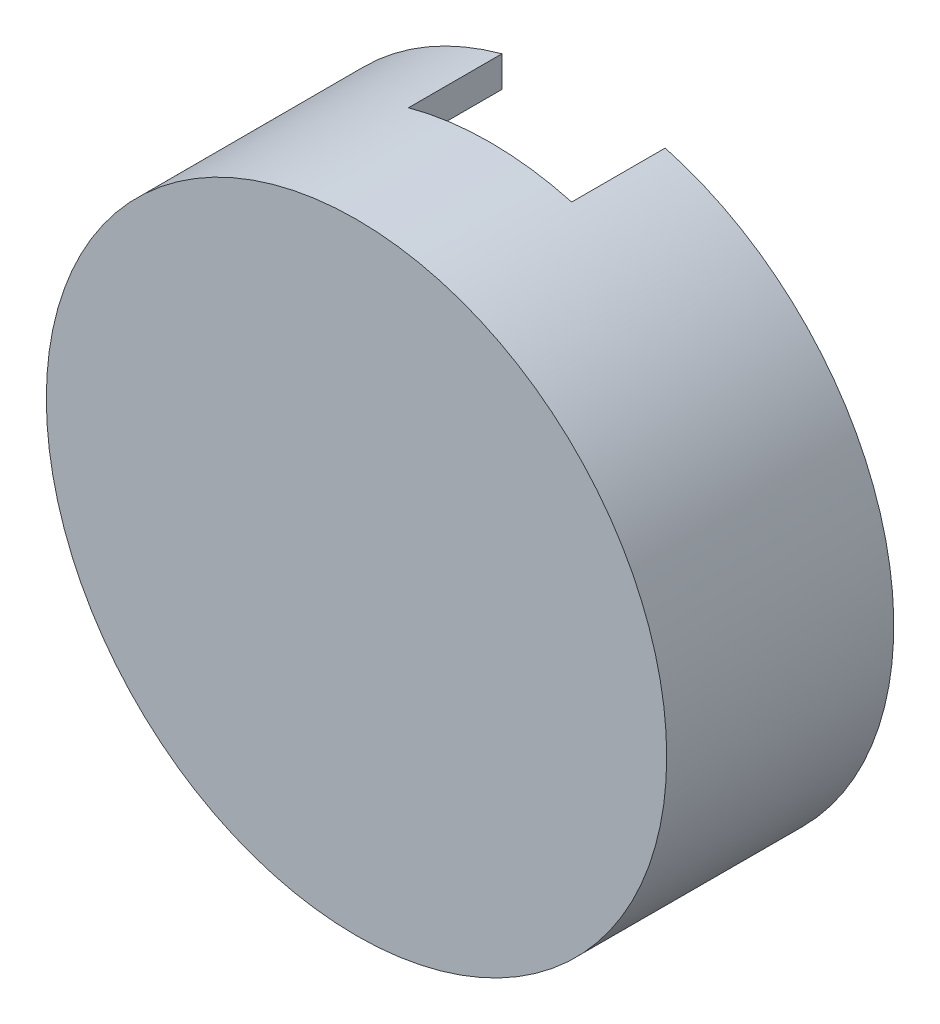
from build123d import *

# Parameters (mm, degrees)
SKIZZE3_W                       = 2.03
SKIZZE3_H                       = 2.5
AUFSATZ_LINEAR_AUSTRAGEN1_DEPTH = 18.902
SKIZZE3_3_W                     = 2.03
SKIZZE3_3_H                     = 2.5
SCHNITT_LINEAR_AUSTRAGEN3_DEPTH = 16.402
SKIZZE2_W                       = 11
SKIZZE2_H                       = 6.3
SCHNITT_LINEAR_AUSTRAGEN4_DEPTH = 23


with BuildPart() as part:
    # Skizze1 → Rotation2 (revolve)
    with BuildSketch(Plane(origin=(0, 0, 0), x_dir=(1, 0, 0), z_dir=(0, 1, 0))):
        Polygon((0.00340061, -8.034840547), (0.00340061, -10.034840547), (20.90540061, -10.034840547), (20.90540061, 5.265159453), (18.90540061, 5.265159453), (18.90540061, -2.034840547), (17.40540061, -2.034840547), (17.40540061, -4.034840547), (18.90540061, -4.034840547), (18.90540061, -8.034840547), align=None)
    revolve(axis=Axis((0.00340061, 0, 8.034840547), (0, 0, 1)))

    # Skizze3 → Aufsatz-Linear austragen1 (add)
    with BuildSketch(Plane(origin=(0, 0, 0), x_dir=(0, 0, -1), z_dir=(1, 0, 0))):
        with Locations((-1.015, 0)):
            Rectangle(SKIZZE3_W, SKIZZE3_H)
    extrude(amount=-AUFSATZ_LINEAR_AUSTRAGEN1_DEPTH)

    # Skizze3<3> → Schnitt-Linear austragen3 (cut)
    with BuildSketch(Plane(origin=(0, 0, 0), x_dir=(0, 0, -1), z_dir=(1, 0, 0))):
        with Locations((-1.015, 0)):
            Rectangle(SKIZZE3_3_W, SKIZZE3_3_H)
    extrude(amount=-SCHNITT_LINEAR_AUSTRAGEN3_DEPTH, mode=Mode.SUBTRACT)

    # Skizze2 → Schnitt-Linear austragen4 (cut)
    with BuildSketch(Plane(origin=(0, 0, 0), x_dir=(1, 0, 0), z_dir=(0, 1, 0))):
        with Locations((0.00340061, 2.115159453)):
            Rectangle(SKIZZE2_W, SKIZZE2_H)
    extrude(amount=SCHNITT_LINEAR_AUSTRAGEN4_DEPTH, mode=Mode.SUBTRACT)


solid = part.part
